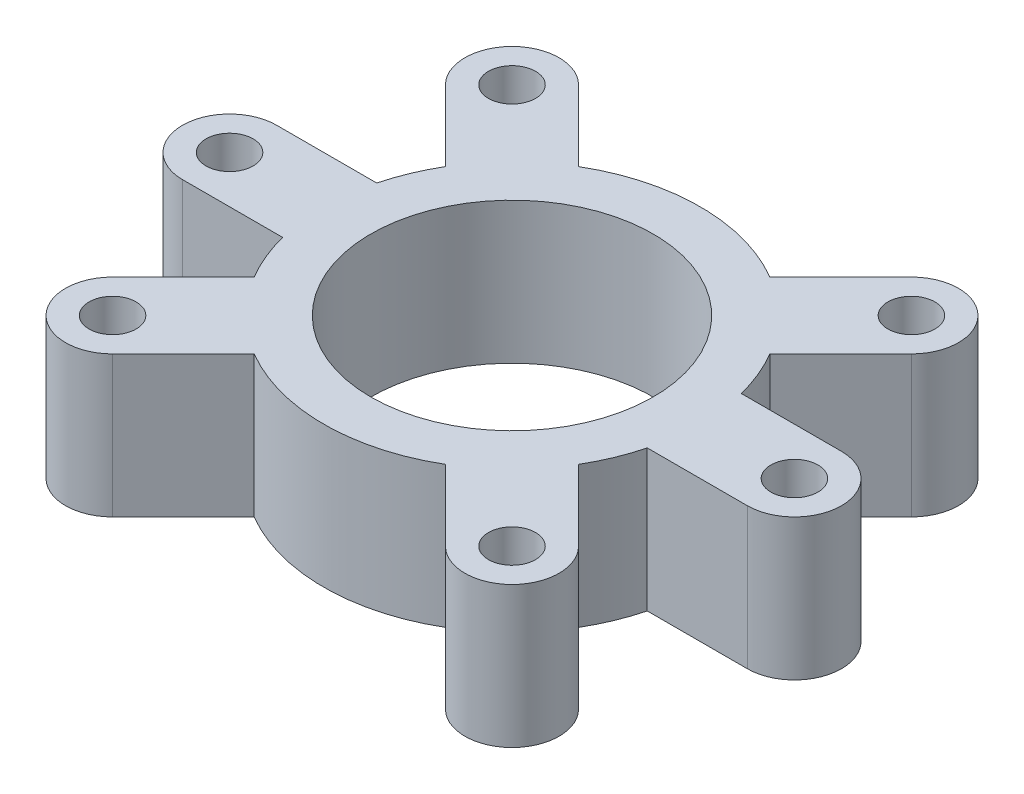
from build123d import *

# Parameters (mm, degrees)
SKETCH2_R           = 30
SKETCH2_R_2         = 5
BOSS_EXTRUDE1_DEPTH = 15


with BuildPart() as part:
    # Sketch2 → Boss-Extrude1 (new, symmetric)
    with BuildSketch(Plane(origin=(0, 0, 0), x_dir=(1, 0, 0), z_dir=(0, 1, 0))):
        with BuildLine():
            Line((38.729833462, 10), (60, 10))
            ThreePointArc((60, 10), (70, 0), (60, -10))
            Line((60, -10), (38.729833462, -10))
            ThreePointArc((38.729833462, -10), (36.9551813, -15.307337295), (34.457195687, -20.315060063))
            Line((34.457195687, -20.315060063), (49.497474683, -35.355339059))
            ThreePointArc((49.497474683, -35.355339059), (49.497474683, -49.497474683), (35.355339059, -49.497474683))
            Line((35.355339059, -49.497474683), (20.315060063, -34.457195687))
            ThreePointArc((20.315060063, -34.457195687), (0, -40), (-20.315060063, -34.457195687))
            Line((-20.315060063, -34.457195687), (-35.355339059, -49.497474683))
            ThreePointArc((-35.355339059, -49.497474683), (-49.497474683, -49.497474683), (-49.497474683, -35.355339059))
            Line((-49.497474683, -35.355339059), (-34.457195687, -20.315060063))
            ThreePointArc((-34.457195687, -20.315060063), (-36.9551813, -15.307337295), (-38.729833462, -10))
            Line((-38.729833462, -10), (-60, -10))
            ThreePointArc((-60, -10), (-70, 0), (-60, 10))
            Line((-60, 10), (-38.729833462, 10))
            ThreePointArc((-38.729833462, 10), (-36.9551813, 15.307337295), (-34.457195687, 20.315060063))
            Line((-34.457195687, 20.315060063), (-49.497474683, 35.355339059))
            ThreePointArc((-49.497474683, 35.355339059), (-49.497474683, 49.497474683), (-35.355339059, 49.497474683))
            Line((-35.355339059, 49.497474683), (-20.315060063, 34.457195687))
            ThreePointArc((-20.315060063, 34.457195687), (0, 40), (20.315060063, 34.457195687))
            Line((20.315060063, 34.457195687), (35.355339059, 49.497474683))
            ThreePointArc((35.355339059, 49.497474683), (49.497474683, 49.497474683), (49.497474683, 35.355339059))
            Line((49.497474683, 35.355339059), (34.457195687, 20.315060063))
            ThreePointArc((34.457195687, 20.315060063), (36.9551813, 15.307337295), (38.729833462, 10))
        make_face()
        with Locations(Location((0, 0, 0), (0, 0, 270))):
            Circle(SKETCH2_R, mode=Mode.SUBTRACT)
        with Locations(Location((60, 0, 0), (0, 0, 270))):
            Circle(SKETCH2_R_2, mode=Mode.SUBTRACT)
        with Locations(Location((42.426406871, -42.426406871, 0), (0, 0, 270))):
            Circle(SKETCH2_R_2, mode=Mode.SUBTRACT)
        with Locations(Location((-42.426406871, -42.426406871, 0), (0, 0, 270))):
            Circle(SKETCH2_R_2, mode=Mode.SUBTRACT)
        with Locations(Location((-60, 0, 0), (0, 0, 270))):
            Circle(SKETCH2_R_2, mode=Mode.SUBTRACT)
        with Locations(Location((-42.426406871, 42.426406871, 0), (0, 0, 270))):
            Circle(SKETCH2_R_2, mode=Mode.SUBTRACT)
        with Locations(Location((42.426406871, 42.426406871, 0), (0, 0, 270))):
            Circle(SKETCH2_R_2, mode=Mode.SUBTRACT)
    extrude(amount=BOSS_EXTRUDE1_DEPTH, both=True)


solid = part.part
